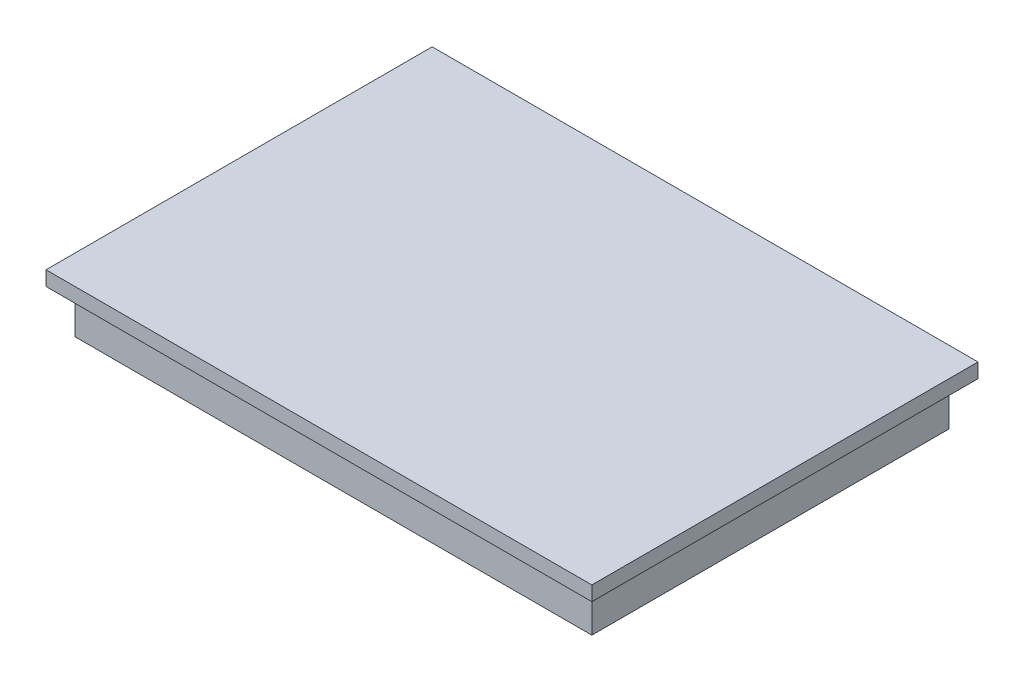
from build123d import *

# Parameters (mm, degrees)
SKETCH1_W           = 168
SKETCH1_H           = 113
BOSS_EXTRUDE1_DEPTH = 20
BOSS_EXTRUDE4_DEPTH = 5


with BuildPart() as part:
    # Sketch1 → Boss-Extrude1 (new body)
    with BuildSketch(Plane(origin=(0, 0, 0), x_dir=(1, 0, 0), z_dir=(0, 1, 0))):
        Polygon((178, 0), (0, 0), (0, -5), (0, -123), (178, -123), align=None)
        with Locations((89, -61.5)):
            Rectangle(SKETCH1_W, SKETCH1_H, mode=Mode.SUBTRACT)
    extrude(amount=BOSS_EXTRUDE1_DEPTH)

    # Sketch2 → Boss-Extrude4 (add)
    with BuildSketch(Plane(origin=(0, 20, 0), x_dir=(1, 0, 0), z_dir=(0, 1, 0))):
        Polygon((183, 5), (0, 5), (-5, 5), (-5, -128), (183, -128), align=None)
    extrude(amount=-BOSS_EXTRUDE4_DEPTH)


solid = part.part
